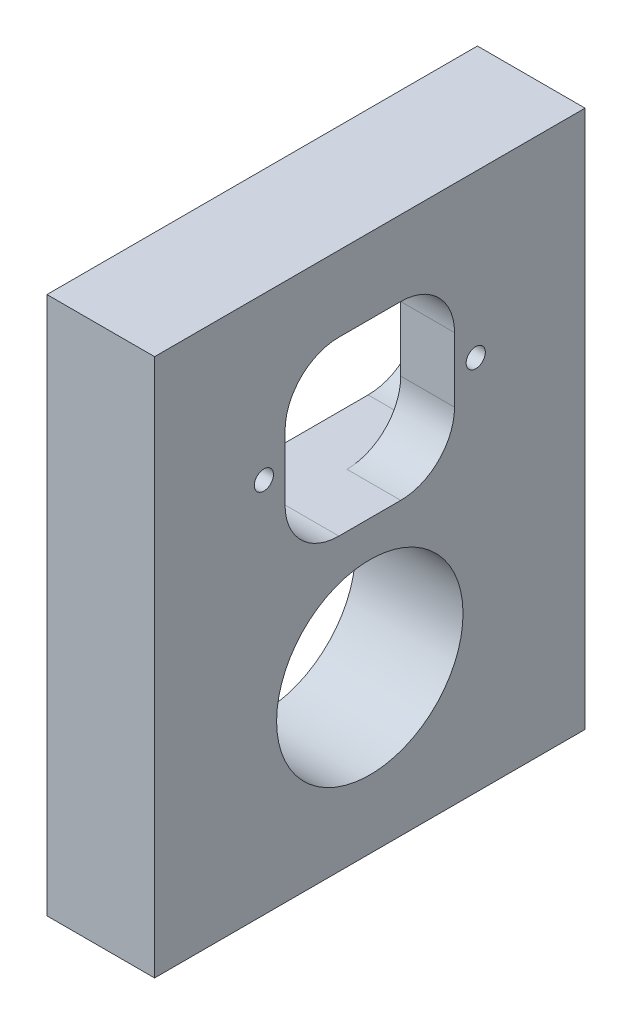
from build123d import *

# Parameters (mm, degrees)
SKETCH1_W                  = 50.8
SKETCH1_H                  = 63.5
BOSS_EXTRUDE1_DEPTH        = 12.7
F_22_0_22_DIAMETER_HOLE1_D = 22
F_4_40_TAPPED_HOLE1_D      = 2.2606
CUT_EXTRUDE1_DEPTH         = 43.597094971
CUT_EXTRUDE2_DEPTH         = 6.35


with BuildPart() as part:
    # Sketch1 → Boss-Extrude1 (new body)
    with BuildSketch(Plane(origin=(0, 0, 0), x_dir=(0, 0, -1), z_dir=(1, 0, 0))):
        Rectangle(SKETCH1_W, SKETCH1_H)
    extrude(amount=BOSS_EXTRUDE1_DEPTH)

    # Ø22.0 (22) Diameter Hole1 (through all)
    with Locations(Plane(origin=(12.7, 0, 0), x_dir=(0, 0, -1), z_dir=(1, 0, 0))):
        with Locations((0, -12.7)):
            Hole(F_22_0_22_DIAMETER_HOLE1_D / 2)

    # Sketch4 → 1/16 NPT Tapped Hole1 (revolve, cut)
    with BuildSketch(Plane.ZX.offset(12.7)):
        Polygon((0, 0), (0, 13.530685027), (3.0734, 11.684), (3.0734, 6.858), (3.762574096, 6.858), (3.9679118, 0), align=None)
    revolve(axis=Axis((-6.35, 12.7, 0), (1, 0, 0)), mode=Mode.SUBTRACT)

    # #4-40 Tapped Hole1 (through all)
    with Locations(Plane(origin=(12.7, 0, 0), x_dir=(0, 0, -1), z_dir=(1, 0, 0))):
        with Locations((-12.5, 12.7), (12.5, 12.7)):
            Hole(F_4_40_TAPPED_HOLE1_D / 2)

    # Sketch9 → Cut-Extrude1 (cut, through all)
    with BuildSketch(Plane(origin=(12.7, 0, 0), x_dir=(0, 0, -1), z_dir=(1, 0, 0))):
        with BuildLine():
            Line((-3.65, 2.54), (3.65, 2.54))
            ThreePointArc((3.65, 2.54), (8.140128061, 4.399871939), (10, 8.89))
            Line((10, 8.89), (10, 16.51))
            ThreePointArc((10, 16.51), (8.140128061, 21.000128061), (3.65, 22.86))
            Line((3.65, 22.86), (-3.65, 22.86))
            ThreePointArc((-3.65, 22.86), (-8.140128061, 21.000128061), (-10, 16.51))
            Line((-10, 16.51), (-10, 8.89))
            ThreePointArc((-10, 8.89), (-8.140128061, 4.399871939), (-3.65, 2.54))
        make_face()
    extrude(amount=-CUT_EXTRUDE1_DEPTH, mode=Mode.SUBTRACT)

    # Sketch10 → Cut-Extrude2 (cut)
    with BuildSketch(Plane(origin=(0, 0, 0), x_dir=(0, 0, -1), z_dir=(1, 0, 0))):
        with BuildLine():
            Line((-12.5, 2.54), (12.5, 2.54))
            ThreePointArc((12.5, 2.54), (16.990128061, 4.399871939), (18.85, 8.89))
            Line((18.85, 8.89), (18.85, 16.51))
            ThreePointArc((18.85, 16.51), (16.990128061, 21.000128061), (12.5, 22.86))
            Line((12.5, 22.86), (-12.5, 22.86))
            ThreePointArc((-12.5, 22.86), (-16.990128061, 21.000128061), (-18.85, 16.51))
            Line((-18.85, 16.51), (-18.85, 8.89))
            ThreePointArc((-18.85, 8.89), (-16.990128061, 4.399871939), (-12.5, 2.54))
        make_face()
    extrude(amount=CUT_EXTRUDE2_DEPTH, mode=Mode.SUBTRACT)


solid = part.part
